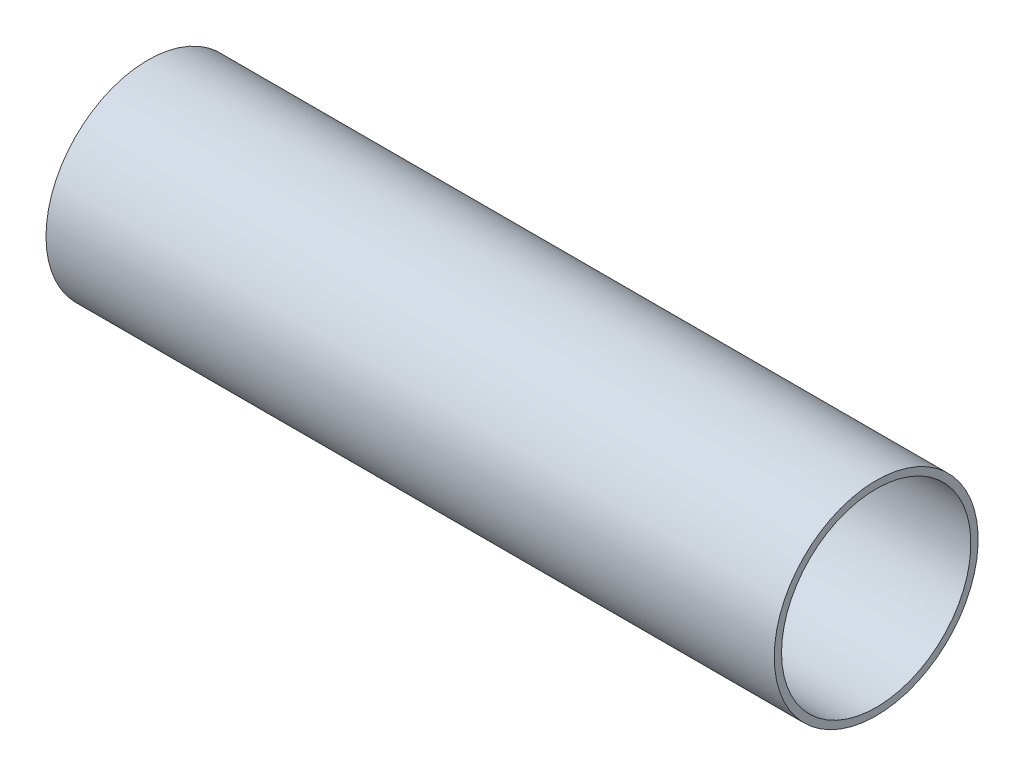
from build123d import *

# Parameters (mm, degrees)
ESQUISSE1_W = 100
ESQUISSE1_H = 1


with BuildPart() as part:
    # Esquisse1 → Base-Révolution (revolve)
    with BuildSketch(Plane.XY, mode=Mode.PRIVATE) as base_r_volution_sk:
        with Locations((50, 13.5)):
            Rectangle(ESQUISSE1_W, ESQUISSE1_H)
    revolve(base_r_volution_sk.sketch.rotate(Axis((0, 0, 0), (1, 0, 0)), 90), axis=Axis((0, 0, 0), (1, 0, 0)))


solid = part.part
